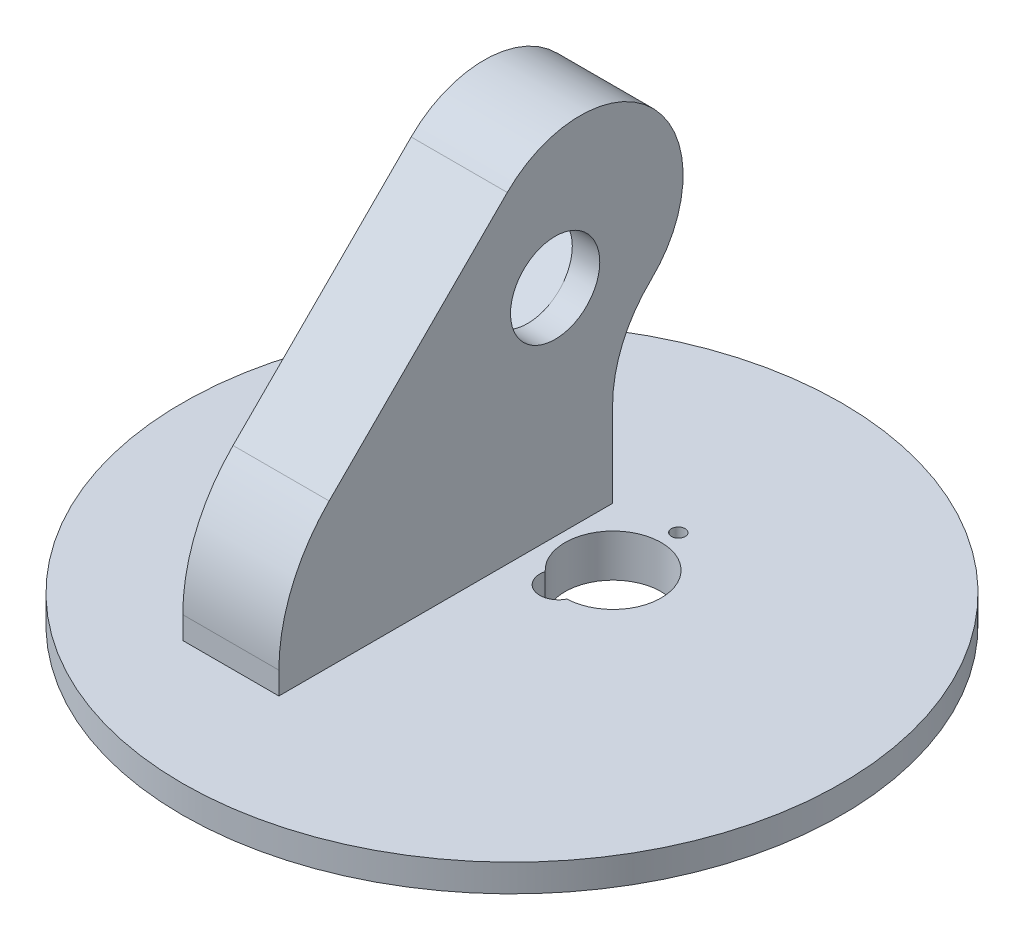
from build123d import *

# Parameters (mm, degrees)
SKETCH2_R           = 48
BOSS_EXTRUDE1_DEPTH = 4
BOSS_EXTRUDE2_DEPTH = 14
SKETCH31_R          = 6.5
CUT_EXTRUDE18_DEPTH = 96.977067922
CUT_EXTRUDE19_DEPTH = 10
SKETCH32_R          = 1
CUT_EXTRUDE20_DEPTH = 4.5
SKETCH33_R          = 43.5
BOSS_EXTRUDE3_DEPTH = 2.2
SKETCH35_R          = 7
CUT_EXTRUDE22_DEPTH = 93.968532394
SKETCH36_R          = 2.701818283
CUT_EXTRUDE24_DEPTH = 86.072189458
SKETCH37_R          = 1
CUT_EXTRUDE25_DEPTH = 4.5


with BuildPart() as part:
    # Sketch2 → Boss-Extrude1 (new body)
    with BuildSketch(Plane(origin=(0, 0, 0), x_dir=(1, 0, 0), z_dir=(0, 1, 0))):
        Circle(SKETCH2_R)
    extrude(amount=BOSS_EXTRUDE1_DEPTH)

    # Sketch7 → Boss-Extrude2 (add)
    with BuildSketch(Plane(origin=(-4, 0, 0), x_dir=(0, 0, -1), z_dir=(1, 0, 0))):
        with BuildLine():
            Line((18.652115716, 4), (18.652115716, 16.356133126))
            ThreePointArc((18.652115716, 16.356133126), (20.111216245, 23.455333411), (24.251965127, 29.403595153))
            ThreePointArc((24.251965127, 29.403595153), (24.659117989, 50.747356958), (3.311904584, 50.883081894))
            Line((3.311904584, 50.883081894), (-22.631121669, 24.94005564))
            ThreePointArc((-22.631121669, 24.94005564), (-28.050440452, 16.82947192), (-29.95345214, 7.262386111))
            Line((-29.95345214, 7.262386111), (-29.95345214, 4))
            Line((-29.95345214, 4), (18.652115716, 4))
        make_face()
    extrude(amount=-BOSS_EXTRUDE2_DEPTH)

    # Sketch31 → Cut-Extrude18 (cut, through all)
    with BuildSketch(Plane(origin=(-18, 10.461755651, -5.359516796), x_dir=(0, 0, 1), z_dir=(-1, 0, 0))):
        with Locations((-4.922469695, 24.905412087)):
            Circle(SKETCH31_R)
    extrude(amount=-CUT_EXTRUDE18_DEPTH, mode=Mode.SUBTRACT)

    # Sketch31<3> → Cut-Extrude19 (cut)
    with BuildSketch(Plane(origin=(-18, 10.461755651, -5.359516796), x_dir=(0, 0, 1), z_dir=(-1, 0, 0))):
        Polygon((-5.41546104, 34.054639751), (11.74960782, 18.74580534), (3.09678837, 9.043809897), (-14.06828049, 24.352644308), align=None)
    extrude(amount=-CUT_EXTRUDE19_DEPTH, mode=Mode.SUBTRACT)

    # Sketch32 → Cut-Extrude20 (cut)
    with BuildSketch(Plane.ZY.offset(18)):
        with Locations((-17.080620038, 41.264504586)):
            Circle(SKETCH32_R)
        with Locations((3.929449654, 22.692559529)):
            Circle(SKETCH32_R)
    extrude(amount=-CUT_EXTRUDE20_DEPTH, mode=Mode.SUBTRACT)

    # Sketch33 → Boss-Extrude3 (add)
    with BuildSketch(Plane.XZ):
        Circle(SKETCH33_R)
    extrude(amount=BOSS_EXTRUDE3_DEPTH)

    # Sketch35 → Cut-Extrude22 (cut, through all)
    with BuildSketch(Plane(origin=(-3.192833023, 4, -10.250875044), x_dir=(1, 0, 0), z_dir=(0, 1, 0))):
        with Locations((7.665516898, 0)):
            Circle(SKETCH35_R)
    extrude(amount=-CUT_EXTRUDE22_DEPTH, mode=Mode.SUBTRACT)

    # Sketch36 → Cut-Extrude24 (cut, through all)
    with BuildSketch(Plane(origin=(0, 4, 0), x_dir=(1, 0, 0), z_dir=(0, 1, 0))):
        with Locations((2.310071728, 4.444115209)):
            Circle(SKETCH36_R)
    extrude(amount=-CUT_EXTRUDE24_DEPTH, mode=Mode.SUBTRACT)

    # Sketch37 → Cut-Extrude25 (cut)
    with BuildSketch(Plane(origin=(0, 4, 0), x_dir=(1, 0, 0), z_dir=(0, 1, 0))):
        with Locations((4.472683875, 19.750875044)):
            Circle(SKETCH37_R)
    extrude(amount=-CUT_EXTRUDE25_DEPTH, mode=Mode.SUBTRACT)


solid = part.part
